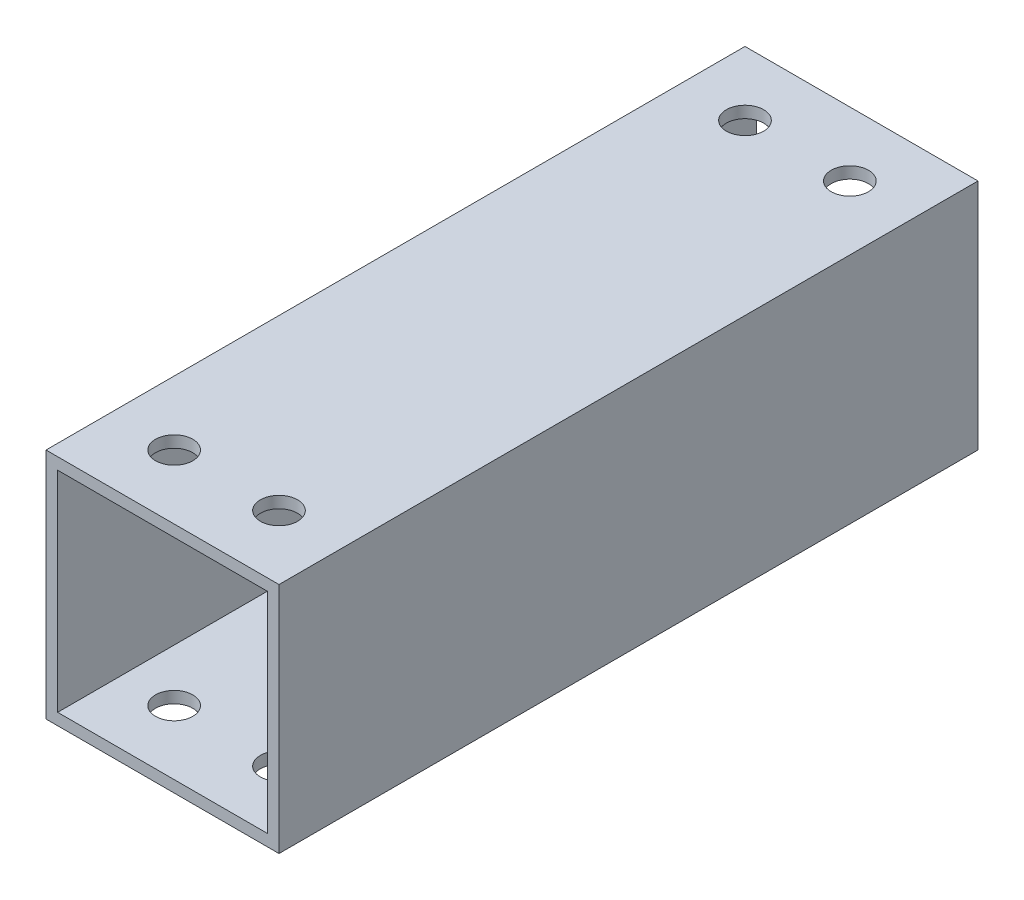
from build123d import *

# Parameters (mm, degrees)
SKETCH_1_W          = 20
SKETCH_1_H          = 20
SKETCH_1_W_2        = 18
SKETCH_1_H_2        = 18
EXTRUDE_1_DEPTH     = 60
SKETCH_2_R          = 1.6
CUT_EXTRUDE_1_DEPTH = 65.031242374


with BuildPart() as part:
    # 草图1 → 凸台-拉伸1 (new body)
    with BuildSketch(Plane.XY):
        Rectangle(SKETCH_1_W, SKETCH_1_H)
        Rectangle(SKETCH_1_W_2, SKETCH_1_H_2, mode=Mode.SUBTRACT)
    extrude(amount=EXTRUDE_1_DEPTH)

    # 草图2 → 切除-拉伸1 (cut, through all)
    with BuildSketch(Plane(origin=(0, 10, 0), x_dir=(1, 0, 0), z_dir=(0, 1, 0))):
        with Locations(Location((-4.5, -5.5, 0), (0, 0, 270))):
            Circle(SKETCH_2_R)
        with Locations(Location((4.5, -5.5, 0), (0, 0, 270))):
            Circle(SKETCH_2_R)
        with Locations(Location((4.5, -54.5, 0), (0, 0, 270))):
            Circle(SKETCH_2_R)
        with Locations(Location((-4.5, -54.5, 0), (0, 0, 270))):
            Circle(SKETCH_2_R)
    extrude(amount=-CUT_EXTRUDE_1_DEPTH, mode=Mode.SUBTRACT)


solid = part.part
